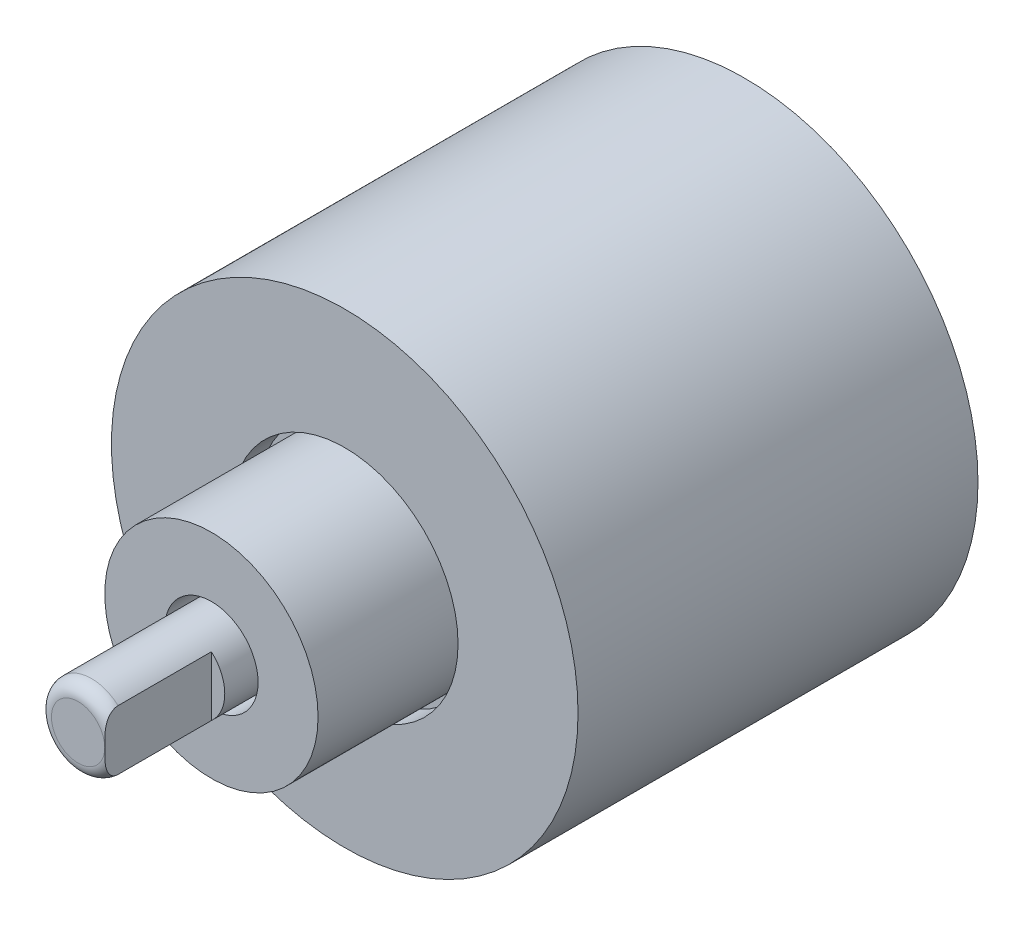
from build123d import *

# Parameters (mm, degrees)
SKETCH_1_R          = 17.5
EXTRUDE_1_DEPTH     = 30
SKETCH_2_R          = 8
EXTRUDE_2_DEPTH     = 10
CUT_EXTRUDE_START   = -2
SKETCH_3_R          = 8.5
SKETCH_3_R_2        = 8
CUT_EXTRUDE_1_DEPTH = 2
SKETCH_4_R          = 3
EXTRUDE_3_DEPTH     = 10
CUT_EXTRUDE_START_2 = -12
SKETCH_5_R          = 3.5
SKETCH_5_R_2        = 3
CUT_EXTRUDE_2_DEPTH = 12
FILLET_1_R          = 1
SKETCH_6_W          = 2.555325261
SKETCH_6_H          = 9.362978713
CUT_EXTRUDE_3_DEPTH = 8


with BuildPart() as part:
    # 草图1 → 凸台-拉伸1 (new body)
    with BuildSketch(Plane.XY):
        Circle(SKETCH_1_R)
    extrude(amount=EXTRUDE_1_DEPTH)

    # 草图2 → 凸台-拉伸2 (add)
    with BuildSketch(Plane.XY.offset(30)):
        Circle(SKETCH_2_R)
    extrude(amount=EXTRUDE_2_DEPTH)

    # 草图3 → 切除-拉伸1 (cut)
    with BuildSketch(Plane.XY.offset(30).offset(CUT_EXTRUDE_START)):
        Circle(SKETCH_3_R)
        Circle(SKETCH_3_R_2, mode=Mode.SUBTRACT)
    extrude(amount=CUT_EXTRUDE_1_DEPTH, mode=Mode.SUBTRACT)

    # 草图4 → 凸台-拉伸3 (add)
    with BuildSketch(Plane.XY.offset(40)):
        Circle(SKETCH_4_R)
    extrude(amount=EXTRUDE_3_DEPTH)

    # 草图5 → 切除-拉伸2 (cut)
    with BuildSketch(Plane.XY.offset(40).offset(CUT_EXTRUDE_START_2)):
        Circle(SKETCH_5_R)
        Circle(SKETCH_5_R_2, mode=Mode.SUBTRACT)
    extrude(amount=CUT_EXTRUDE_2_DEPTH, mode=Mode.SUBTRACT)

    # 圆角1
    fillet_1_edges = [part.edges().sort_by_distance(p)[0] for p in [
        (-3, 0, 50),
    ]]
    fillet(fillet_1_edges, radius=FILLET_1_R)

    # 草图6 → 切除-拉伸3 (cut)
    with BuildSketch(Plane.XY.offset(50)):
        with Locations((3.277662631, -1.004075507)):
            Rectangle(SKETCH_6_W, SKETCH_6_H)
    extrude(amount=-CUT_EXTRUDE_3_DEPTH, mode=Mode.SUBTRACT)


solid = part.part
